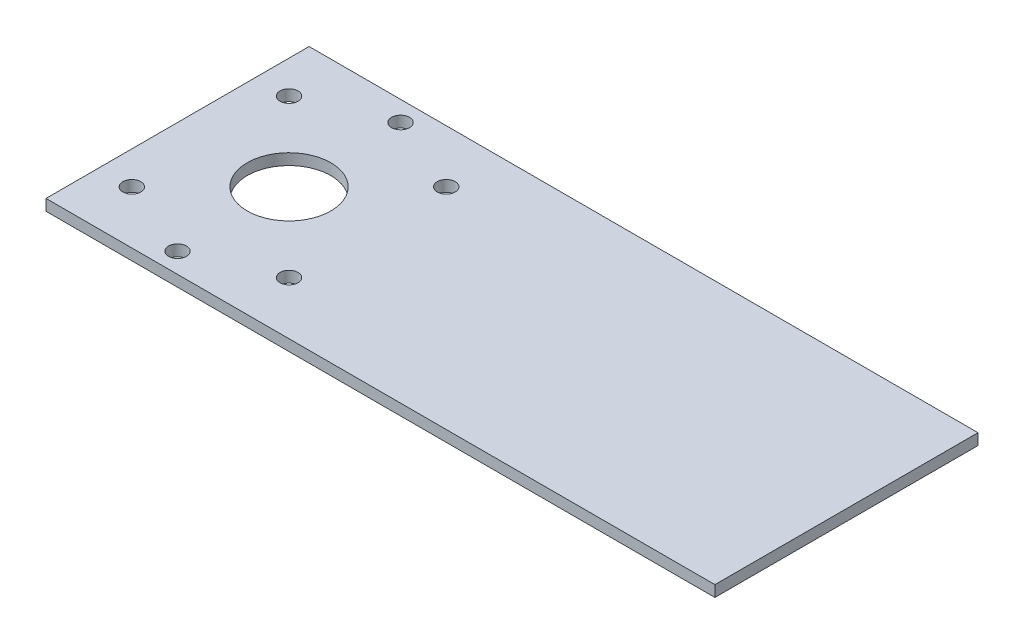
from build123d import *

# Parameters (mm, degrees)
SKETCH1_W                   = 152.4
SKETCH1_H                   = 59.944
BOSS_EXTRUDE1_DEPTH         = 2.54
F_97_0_161_DIAMETER_HOLE1_D = 4.0894
F_97_0_75_DIAMETER_HOLE1_D  = 19.05


with BuildPart() as part:
    # Sketch1 → Boss-Extrude1 (new body)
    with BuildSketch(Plane(origin=(0, 0, 0), x_dir=(1, 0, 0), z_dir=(0, 1, 0))):
        with Locations((-76.2, 29.972)):
            Rectangle(SKETCH1_W, SKETCH1_H)
    extrude(amount=BOSS_EXTRUDE1_DEPTH)

    # #97 (0.161) Diameter Hole1 (through all)
    with Locations(Plane(origin=(0, 2.54, 0), x_dir=(1, 0, 0), z_dir=(0, 1, 0))):
        with Locations((-144.907, 47.879), (-127, 55.372), (-109.093, 47.879), (-109.093, 12.065), (-127, 4.572), (-144.907, 12.065)):
            Hole(F_97_0_161_DIAMETER_HOLE1_D / 2)

    # #97 (0.75) Diameter Hole1 (through all)
    with Locations(Plane(origin=(0, 2.54, 0), x_dir=(1, 0, 0), z_dir=(0, 1, 0))):
        with Locations((-127, 29.972)):
            Hole(F_97_0_75_DIAMETER_HOLE1_D / 2)


solid = part.part
